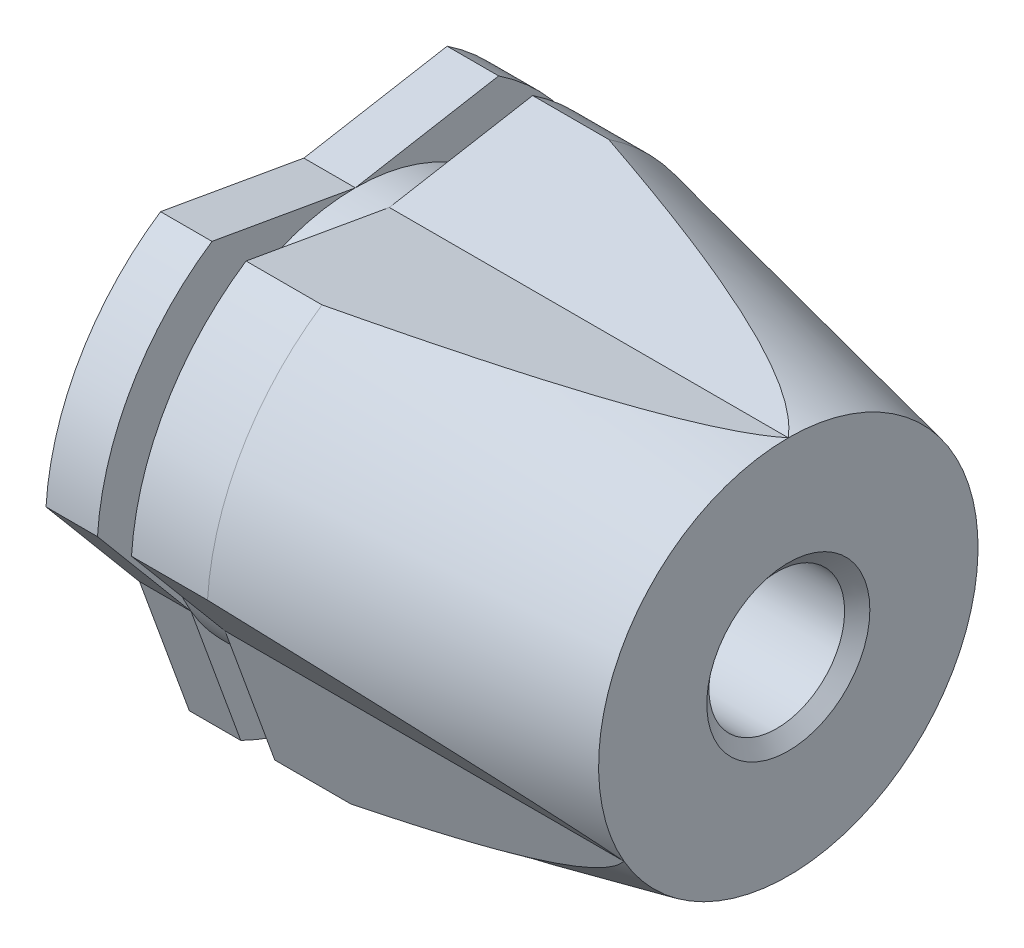
from build123d import *

# Parameters (mm, degrees)
SKETCH1_R                   = 8
BOSS_EXTRUDE1_DEPTH         = 5
SKETCH2_R                   = 8
BOSS_EXTRUDE2_DEPTH         = 10
BOSS_EXTRUDE2_TAPER         = 12
CUT_EXTRUDE5_DEPTH          = 19.788294313
CIRPATTERN1_COUNT           = 3
M5_TAPPED_HOLE1_D           = 4.2
M5_TAPPED_HOLE1_CSINK_D     = 5.05
M5_TAPPED_HOLE1_CSINK_ANGLE = 100
SKETCH6_W                   = 1.053506638
SKETCH6_H                   = 3.031369011


with BuildPart() as part:
    # Sketch1 → Boss-Extrude1 (new body)
    with BuildSketch(Plane(origin=(0, 0, 0), x_dir=(0, 0, -1), z_dir=(1, 0, 0))):
        Circle(SKETCH1_R)
    extrude(amount=BOSS_EXTRUDE1_DEPTH)

    # Sketch2 → Boss-Extrude2 (add)
    with BuildSketch(Plane(origin=(5, 0, 0), x_dir=(0, 0, -1), z_dir=(1, 0, 0))):
        Circle(SKETCH2_R)
    extrude(amount=BOSS_EXTRUDE2_DEPTH, taper=BOSS_EXTRUDE2_TAPER)

    # Sketch3 → Cut-Extrude5 (cut, through all)
    with BuildSketch(Plane(origin=(15, 0, 0), x_dir=(0, 0, -1), z_dir=(1, 0, 0))):
        with BuildLine():
            Line((0, 5.874434383), (11.406864113, 7.885772292))
            ThreePointArc((11.406864113, 7.885772292), (0.570239316, 16.679095968), (-10.070915149, 7.650208444))
            Line((-10.070915149, 7.650208444), (0, 5.874434383))
        make_face()
    cut_extrude5 = extrude(amount=-CUT_EXTRUDE5_DEPTH, mode=Mode.SUBTRACT)

    # CirPattern1: Cut-Extrude5 ×3 about axis
    cirpattern1_axis = Axis((0, 0, 0), (1, 0, 0))
    for i in range(1, CIRPATTERN1_COUNT):
        add(cut_extrude5.rotate(cirpattern1_axis, i * 360 / CIRPATTERN1_COUNT), mode=Mode.SUBTRACT)

    # M5 Tapped Hole1 (through all)
    with Locations(Plane(origin=(15, 0, 0), x_dir=(0, 0, -1), z_dir=(1, 0, 0))):
        with Locations((0, 0)):
            CounterSinkHole(M5_TAPPED_HOLE1_D / 2, M5_TAPPED_HOLE1_CSINK_D / 2, counter_sink_angle=M5_TAPPED_HOLE1_CSINK_ANGLE)

    # Sketch6 → Cut-Revolve2 (revolve, cut)
    with BuildSketch(Plane.XY, mode=Mode.PRIVATE) as cut_revolve2_sk:
        with Locations((2.120528078, 7.390118889)):
            Rectangle(SKETCH6_W, SKETCH6_H)
    revolve(cut_revolve2_sk.sketch.rotate(Axis((0, 0, 0), (1, 0, 0)), 270), axis=Axis((0, 0, 0), (1, 0, 0)), mode=Mode.SUBTRACT)


solid = part.part
